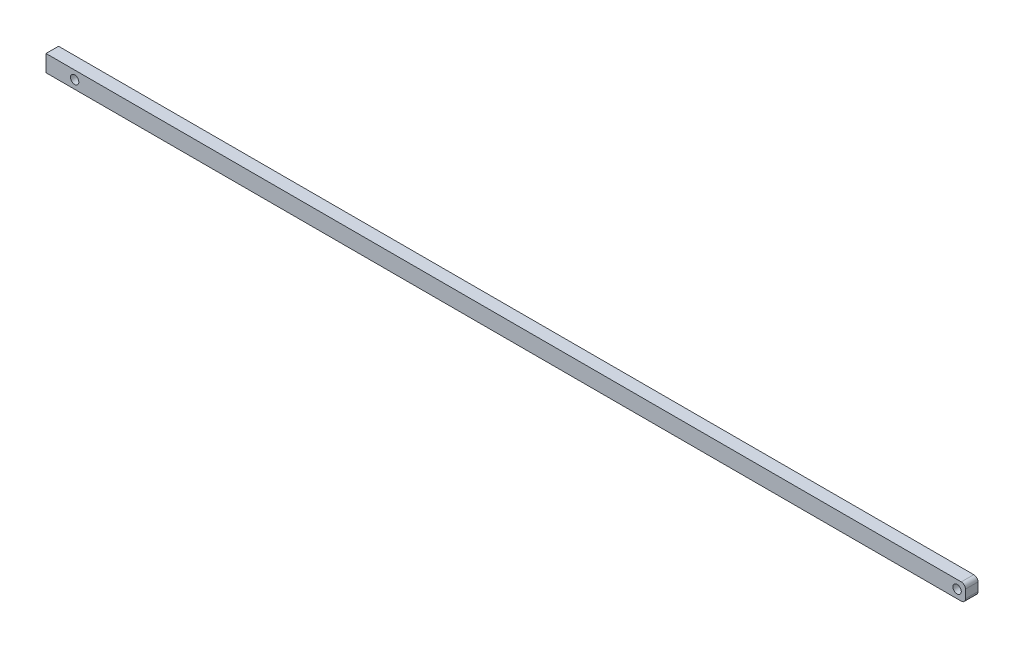
from build123d import *

# Parameters (mm, degrees)
ESQUISSE1_W             = 220
ESQUISSE1_H             = 4
BOSS_EXTRU_1_DEPTH      = 3
ESQUISSE2_R             = 1
ENL_V_MAT_EXTRU_1_DEPTH = 6
CONG_1_R                = 1
CONG_2_R                = 1


with BuildPart() as part:
    # Esquisse1 → Boss.-Extru.1 (new body)
    with BuildSketch(Plane.XY):
        with Locations((-110, 2)):
            Rectangle(ESQUISSE1_W, ESQUISSE1_H)
    extrude(amount=BOSS_EXTRU_1_DEPTH)

    # Esquisse2 → Enlèv. mat.-Extru.1 (cut)
    with BuildSketch(Plane.XY.offset(3)):
        with Locations((-2, 2)):
            Circle(ESQUISSE2_R)
        with Locations((-213.150378979, 2)):
            Circle(ESQUISSE2_R)
    extrude(amount=-ENL_V_MAT_EXTRU_1_DEPTH, mode=Mode.SUBTRACT)

    # Congé1
    cong_1_edges = [part.edges().sort_by_distance(p)[0] for p in [
        (0, 4, 1.5),
    ]]
    fillet(cong_1_edges, radius=CONG_1_R)

    # Congé2
    cong_2_edges = [part.edges().sort_by_distance(p)[0] for p in [
        (0, 0, 1.5),
    ]]
    fillet(cong_2_edges, radius=CONG_2_R)


solid = part.part
